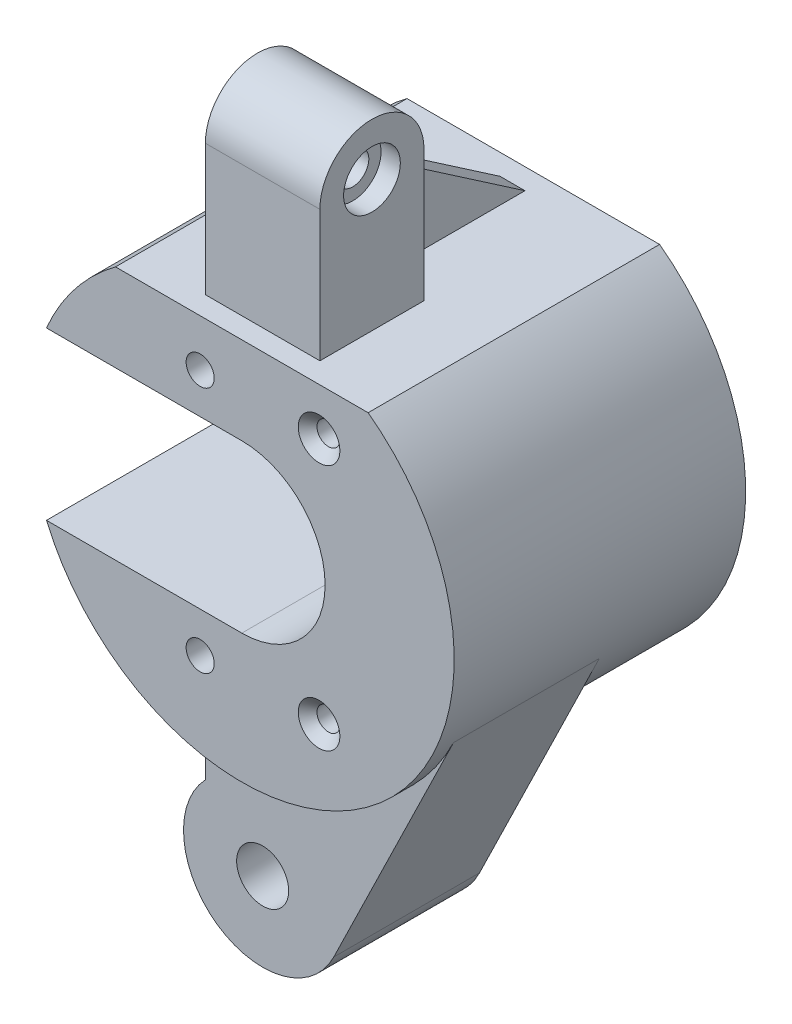
from build123d import *

# Parameters (mm, degrees)
BOSS_EXTRUDE1_DEPTH                              = 140
SKETCH2_W                                        = 55
SKETCH2_H                                        = 50
BOSS_EXTRUDE2_DEPTH                              = 88
CUT_EXTRUDE1_DEPTH                               = 256.480429779
RIB1_REACH                                       = 244.701
SKETCH4_WALL_W                                   = 572.27930611
SKETCH4_WALL_H                                   = 12
SKETCH5_R                                        = 12.5
BOSS_EXTRUDE3_DEPTH                              = 70
CSK_FOR_M10_FLAT_HEAD_MACHINE_SCREW1_D           = 11
CSK_FOR_M10_FLAT_HEAD_MACHINE_SCREW1_CSINK_D     = 20
CSK_FOR_M10_FLAT_HEAD_MACHINE_SCREW1_CSINK_ANGLE = 90
F_10_0MM_DOWEL_HOLE2_D                           = 13.5
F_10_0MM_DOWEL_HOLE2_DEPTH                       = 35.944190822
F_10_0MM_DOWEL_HOLE2_TIP                         = 4.055809178
CBORE_FOR_M14_HEX_HEAD_BOLT1_D                   = 15.5
CBORE_FOR_M14_HEX_HEAD_BOLT1_CBORE_D             = 27.25
CBORE_FOR_M14_HEX_HEAD_BOLT1_CBORE_DEPTH         = 9.25
CUT_EXTRUDE2_START                               = -20
CUT_EXTRUDE2_DEPTH                               = 20


with BuildPart() as part:
    # Sketch1 → Boss-Extrude1 (new body)
    with BuildSketch(Plane.XY):
        with BuildLine():
            Line((0, 40), (-93.829632846, 40))
            ThreePointArc((-93.829632846, 40), (-80.04994488, 63.213972543), (-60.663003552, 82))
            Line((-60.663003552, 82), (60.663003552, 82))
            ThreePointArc((60.663003552, 82), (63.213972543, -80.04994488), (-93.829632846, -40))
            Line((-93.829632846, -40), (0, -40))
            ThreePointArc((0, -40), (40, 0), (0, 40))
        make_face()
    extrude(amount=-BOSS_EXTRUDE1_DEPTH)

    # Sketch2 → Boss-Extrude2 (add)
    with BuildSketch(Plane(origin=(0, 170, 0), x_dir=(1, 0, 0), z_dir=(0, 1, 0))):
        with Locations((0, 35)):
            Rectangle(SKETCH2_W, SKETCH2_H)
    extrude(amount=-BOSS_EXTRUDE2_DEPTH)

    # Sketch3 → Cut-Extrude1 (cut, through all)
    with BuildSketch(Plane.ZY.offset(27.5)):
        with BuildLine():
            ThreePointArc((-60, 145), (-52.67766953, 162.67766953), (-35, 170))
            Line((-35, 170), (-60, 170))
            Line((-60, 170), (-60, 145))
        make_face()
        with BuildLine():
            ThreePointArc((-35, 170), (-17.32233047, 162.67766953), (-10, 145))
            Line((-10, 145), (-10, 170))
            Line((-10, 170), (-35, 170))
        make_face()
    extrude(amount=-CUT_EXTRUDE1_DEPTH, mode=Mode.SUBTRACT)

    # Sketch4 wall → Rib1 (add, up to next)
    with BuildSketch(Plane(origin=(0, 106, -95), x_dir=(0, -0.565528355552, -0.824728851846), z_dir=(0, 0.824728851846, -0.565528355552)), mode=Mode.PRIVATE) as rib1_sk1:
        Rectangle(SKETCH4_WALL_W, SKETCH4_WALL_H)
    rib1_tool1 = extrude(rib1_sk1.sketch, amount=-RIB1_REACH, mode=Mode.PRIVATE) - part.part
    add(rib1_tool1.solids().sort_by_distance((0, 106, -95))[0])

    # Sketch5 → Boss-Extrude3 (add)
    with BuildSketch(Plane.XY.offset(-10)):
        with BuildLine():
            Line((-27.5, -98.222960656), (-27.5, -119.775011916))
            ThreePointArc((-27.5, -119.775011916), (-21.697882646, -177.19618388), (34.154451435, -162.657534247))
            Line((34.154451435, -162.657534247), (91.677738062, -44.712328767))
            ThreePointArc((91.677738062, -44.712328767), (41.779689407, -93.050833167), (-27.5, -98.222960656))
        make_face()
        with Locations((0, -146)):
            Circle(SKETCH5_R, mode=Mode.SUBTRACT)
    extrude(amount=-BOSS_EXTRUDE3_DEPTH)

    # CSK for M10 Flat Head Machine Screw1 (through all)
    with Locations(Plane.XY):
        with Locations((37.094348496, -59.363366731), (37.094348496, 59.363366731)):
            CounterSinkHole(CSK_FOR_M10_FLAT_HEAD_MACHINE_SCREW1_D / 2, CSK_FOR_M10_FLAT_HEAD_MACHINE_SCREW1_CSINK_D / 2, counter_sink_angle=CSK_FOR_M10_FLAT_HEAD_MACHINE_SCREW1_CSINK_ANGLE)

    # Ø10.0mm Dowel Hole2
    with Locations(Plane.XY):
        with Locations((-20, 59.363366731), (-20, -59.363366731)):
            Hole(F_10_0MM_DOWEL_HOLE2_D / 2, depth=F_10_0MM_DOWEL_HOLE2_DEPTH)
            with Locations((0, 0, -(F_10_0MM_DOWEL_HOLE2_DEPTH + F_10_0MM_DOWEL_HOLE2_TIP / 2))):  # 118° drill point
                Cone(0, F_10_0MM_DOWEL_HOLE2_D / 2, F_10_0MM_DOWEL_HOLE2_TIP, mode=Mode.SUBTRACT)

    # CBORE for M14 Hex Head Bolt1 (through all)
    with Locations(Plane(origin=(27.5, 0, 0), x_dir=(0, 0, -1), z_dir=(1, 0, 0))):
        with Locations((35, 145)):
            CounterBoreHole(CBORE_FOR_M14_HEX_HEAD_BOLT1_D / 2, CBORE_FOR_M14_HEX_HEAD_BOLT1_CBORE_D / 2, CBORE_FOR_M14_HEX_HEAD_BOLT1_CBORE_DEPTH)

    # Sketch14 → Cut-Extrude2 (cut)
    with BuildSketch(Plane(origin=(0, 0, -140), x_dir=(-1, 0, 0), z_dir=(0, 0, -1)).offset(CUT_EXTRUDE2_START)):
        with BuildLine():
            Line((0, 50), (88.904443084, 50))
            ThreePointArc((88.904443084, 50), (102, 0), (88.904443084, -50))
            Line((88.904443084, -50), (0, -50))
            ThreePointArc((0, -50), (-50, 0), (0, 50))
        make_face()
    extrude(amount=CUT_EXTRUDE2_DEPTH, mode=Mode.SUBTRACT)


solid = part.part
